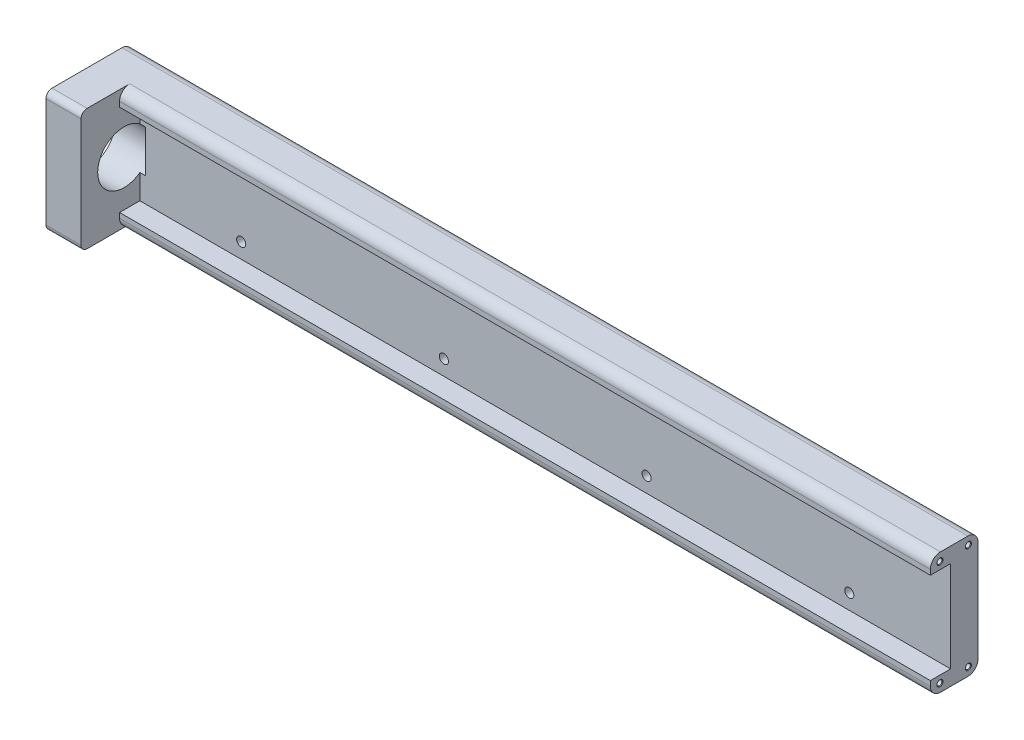
from build123d import *

# Parameters (mm, degrees)
SKETCH_1_W                   = 417.3
SKETCH_1_H                   = 60
EXTRUDE_1_DEPTH              = 23.5
SKETCH_2_W                   = 400
SKETCH_2_H                   = 45
CUT_EXTRUDE_1_DEPTH          = 10
SKETCH_3_W                   = 17.3
SKETCH_3_H                   = 60
EXTRUDE_2_DEPTH              = 19
HOLE_WIZARD_M3_1_D           = 2.5
HOLE_WIZARD_M3_1_DEPTH       = 7.5
HOLE_WIZARD_M3_1_CSINK_D     = 3.05
HOLE_WIZARD_M3_1_CSINK_ANGLE = 90
HOLE_WIZARD_M3_1_TIP         = 0.751075774
FILLET_1_R                   = 5
FILLET_2_R                   = 3
SKETCH_6_R                   = 13
CUT_EXTRUDE_2_DEPTH          = 20
HOLE_WIZARD_M4_1_D           = 3.3
HOLE_WIZARD_M4_1_DEPTH       = 10.1
HOLE_WIZARD_M4_1_CSINK_D     = 4.05
HOLE_WIZARD_M4_1_CSINK_ANGLE = 90
HOLE_WIZARD_M4_1_TIP         = 0.991420021
SKETCH_9_R                   = 2.25
CUT_EXTRUDE_3_DEPTH          = 15


with BuildPart() as part:
    # 草图1 → 凸台-拉伸1 (new body)
    with BuildSketch(Plane.XY):
        with Locations((208.65, -30)):
            Rectangle(SKETCH_1_W, SKETCH_1_H)
    extrude(amount=EXTRUDE_1_DEPTH)

    # 草图2 → 切除-拉伸1 (cut)
    with BuildSketch(Plane.XY.offset(23.5)):
        with Locations((217.3, -30)):
            Rectangle(SKETCH_2_W, SKETCH_2_H)
    extrude(amount=-CUT_EXTRUDE_1_DEPTH, mode=Mode.SUBTRACT)

    # 草图3 → 凸台-拉伸2 (add)
    with BuildSketch(Plane.XY.offset(23.5)):
        with Locations((8.65, -30)):
            Rectangle(SKETCH_3_W, SKETCH_3_H)
    extrude(amount=EXTRUDE_2_DEPTH)

    # M3 螺纹孔1
    with Locations(Plane(origin=(417.3, 0, 0), x_dir=(0, 0, -1), z_dir=(1, 0, 0))):
        with Locations((-4.75, -4), (-18.75, -4), (-18.75, -56), (-4.75, -56)):
            CounterSinkHole(HOLE_WIZARD_M3_1_D / 2, HOLE_WIZARD_M3_1_CSINK_D / 2, depth=HOLE_WIZARD_M3_1_DEPTH, counter_sink_angle=HOLE_WIZARD_M3_1_CSINK_ANGLE)
            with Locations((0, 0, -(HOLE_WIZARD_M3_1_DEPTH + HOLE_WIZARD_M3_1_TIP / 2))):  # 118° drill point
                Cone(0, HOLE_WIZARD_M3_1_D / 2, HOLE_WIZARD_M3_1_TIP, mode=Mode.SUBTRACT)

    # 圆角1
    fillet_1_edges = [part.edges().sort_by_distance(p)[0] for p in [
        (217.3, 0, 23.5),
        (217.3, -60, 23.5),
        (208.65, 0, 0),
        (208.65, -60, 0),
    ]]
    fillet(fillet_1_edges, radius=FILLET_1_R)

    # 圆角2
    fillet_2_edges = [part.edges().sort_by_distance(p)[0] for p in [
        (8.65, -60, 42.5),
        (8.65, 0, 42.5),
    ]]
    fillet(fillet_2_edges, radius=FILLET_2_R)

    # 草图6 → 切除-拉伸2 (cut)
    with BuildSketch(Plane.ZY):
        with Locations(Location((21.3, -30, 0), (0, 0, 270))):
            Circle(SKETCH_6_R)
    extrude(amount=-CUT_EXTRUDE_2_DEPTH, mode=Mode.SUBTRACT)

    # M4 螺纹孔1
    with Locations(Plane.ZY):
        with Locations((9.25, -11), (33.25, -11), (33.25, -49), (9.25, -49)):
            CounterSinkHole(HOLE_WIZARD_M4_1_D / 2, HOLE_WIZARD_M4_1_CSINK_D / 2, depth=HOLE_WIZARD_M4_1_DEPTH, counter_sink_angle=HOLE_WIZARD_M4_1_CSINK_ANGLE)
            with Locations((0, 0, -(HOLE_WIZARD_M4_1_DEPTH + HOLE_WIZARD_M4_1_TIP / 2))):  # 118° drill point
                Cone(0, HOLE_WIZARD_M4_1_D / 2, HOLE_WIZARD_M4_1_TIP, mode=Mode.SUBTRACT)

    # 草图9 → 切除-拉伸3 (cut)
    with BuildSketch(Plane(origin=(0, 0, 0), x_dir=(-1, 0, 0), z_dir=(0, 0, -1))):
        with Locations((-367.3, -15)):
            Circle(SKETCH_9_R)
        with Locations((-267.3, -15)):
            Circle(SKETCH_9_R)
        with Locations((-167.3, -15)):
            Circle(SKETCH_9_R)
        with Locations((-67.3, -15)):
            Circle(SKETCH_9_R)
        with Locations((-267.3, -45)):
            Circle(SKETCH_9_R)
        with Locations((-167.3, -45)):
            Circle(SKETCH_9_R)
        with Locations((-67.3, -45)):
            Circle(SKETCH_9_R)
        with Locations((-367.3, -45)):
            Circle(SKETCH_9_R)
    extrude(amount=-CUT_EXTRUDE_3_DEPTH, mode=Mode.SUBTRACT)


solid = part.part
